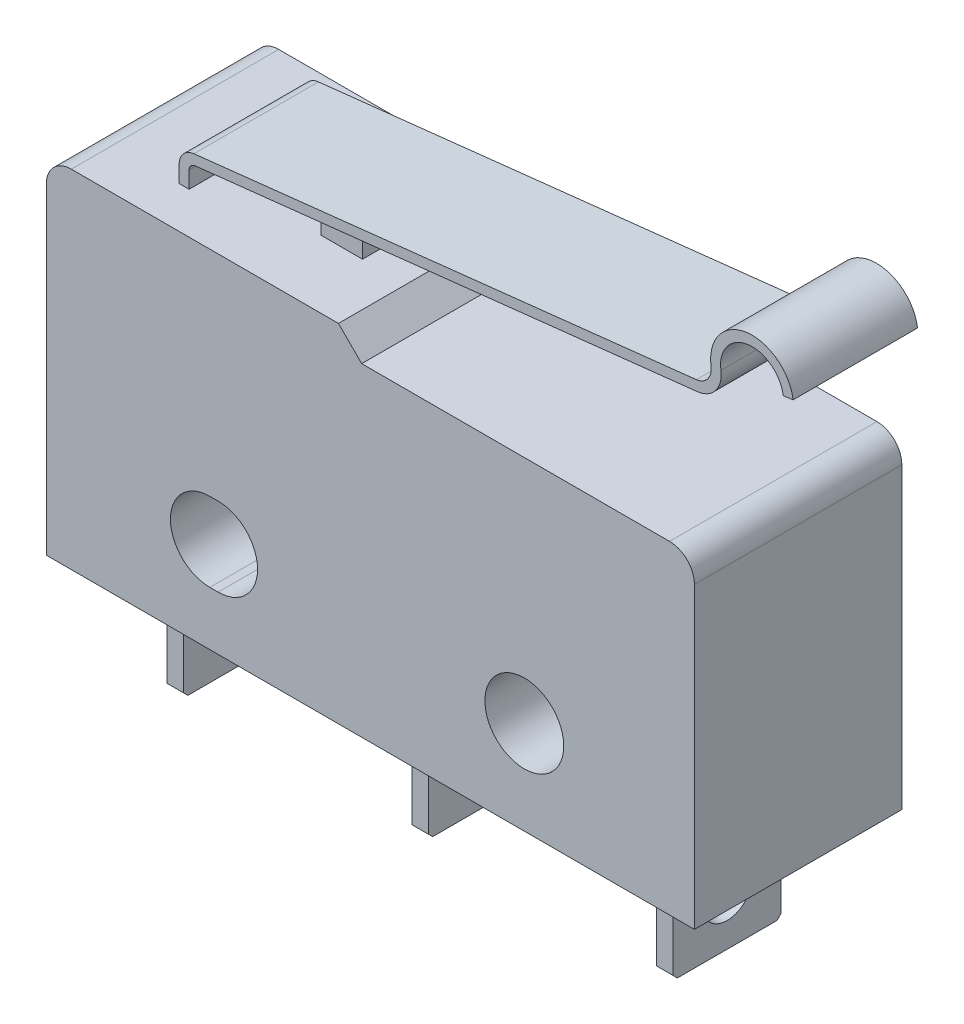
from build123d import *

# Parameters (mm, degrees)
SKETCH2_R           = 1.2065
EXTRUDE1_DEPTH      = 3.175
EXTRUDE2_DEPTH      = 1.1049
SKETCH10_R          = 0.762
EXTRUDE6_DEPTH      = 0.254
LPATTERN1_COUNT     = 3
LPATTERN1_PITCH     = 7.493
EXTRUDE_THIN1_DEPTH = 1.905


with BuildPart() as part:
    # Sketch2 → Extrude1 (new, symmetric)
    with BuildSketch(Plane.XY):
        with BuildLine():
            Line((-9.1567, 10.6172), (-4.9149, 10.6172))
            Line((-4.9149, 10.6172), (-0.9779, 10.6172))
            Line((-0.9779, 10.6172), (-0.2667, 9.906))
            Line((-0.2667, 9.906), (9.1567, 9.906))
            ThreePointArc((9.1567, 9.906), (9.695515367, 9.682815367), (9.9187, 9.144))
            Line((9.9187, 9.144), (9.9187, 0))
            Line((9.9187, 0), (-9.9187, 0))
            Line((-9.9187, 0), (-9.9187, 9.8552))
            ThreePointArc((-9.9187, 9.8552), (-9.695515367, 10.394015367), (-9.1567, 10.6172))
        make_face()
        with Locations((4.7117, 2.8575)):
            Circle(SKETCH2_R, mode=Mode.SUBTRACT)
        with BuildLine():
            Line((-4.9149, 4.064), (-4.6609, 4.064))
            ThreePointArc((-4.6609, 4.064), (-3.4544, 2.8575), (-4.6609, 1.651))
            Line((-4.6609, 1.651), (-4.9149, 1.651))
            ThreePointArc((-4.9149, 1.651), (-6.1214, 2.8575), (-4.9149, 4.064))
        make_face(mode=Mode.SUBTRACT)
    extrude(amount=EXTRUDE1_DEPTH, both=True)

    # Sketch10 → Extrude6 (add, symmetric)
    with BuildSketch(Plane(origin=(-7.493, 0, 0), x_dir=(0, 0, -1), z_dir=(1, 0, 0))):
        Polygon((-1.651, 0), (-1.651, -3.0734), (-1.524, -3.2004), (1.524, -3.2004), (1.651, -3.0734), (1.651, 0), align=None)
        with Locations((0, -1.6764)):
            Circle(SKETCH10_R, mode=Mode.SUBTRACT)
    extrude6 = extrude(amount=EXTRUDE6_DEPTH, both=True)

    # LPattern1: Extrude6 ×3
    with Locations(*[(i * LPATTERN1_PITCH, 0, 0) for i in range(1, LPATTERN1_COUNT)]):
        add(extrude6)



with BuildPart() as body_2:
    # Sketch3 → Extrude2 (new, symmetric)
    with BuildSketch(Plane.XY):
        with BuildLine():
            Line((-3.5814, 10.6172), (-3.5814, 11.524614746))
            ThreePointArc((-3.5814, 11.524614746), (-2.9464, 11.7475), (-2.3114, 11.524614746))
            Line((-2.3114, 11.524614746), (-2.3114, 10.6172))
            Line((-2.3114, 10.6172), (-3.5814, 10.6172))
        make_face()
    extrude(amount=EXTRUDE2_DEPTH, both=True)


with BuildPart() as part_1:
    add(part.part)

    add(body_2.part)  # Extrude-Thin1 merges body 2
    # Sketch11 → Extrude-Thin1 (add, symmetric)
    with BuildSketch(Plane.XY):
        with BuildLine():
            Line((-7.1247, 10.6172), (-7.1247, 11.128280087))
            ThreePointArc((-7.1247, 11.128280087), (-6.995143389, 11.467167386), (-6.672555901, 11.6332))
            Line((-6.672555901, 11.6332), (8.711185108, 13.335))
            ThreePointArc((8.711185108, 13.335), (9.057341476, 13.529355692), (9.157991006, 13.913371366))
            ThreePointArc((9.157991006, 13.913371366), (10.231016869, 15.353654497), (11.6713, 14.280628634))
            Line((11.6713, 14.280628634), (11.369702921, 14.236557762))
            ThreePointArc((11.369702921, 14.236557762), (10.275087741, 15.052057418), (9.459588085, 13.957442238))
            ThreePointArc((9.459588085, 13.957442238), (9.298548838, 13.343017159), (8.744698648, 13.032048052))
            Line((8.744698648, 13.032048052), (-6.63904236, 11.330248052))
            ThreePointArc((-6.63904236, 11.330248052), (-6.768077356, 11.263835007), (-6.8199, 11.128280087))
            Line((-6.8199, 11.128280087), (-6.8199, 10.6172))
            Line((-6.8199, 10.6172), (-7.1247, 10.6172))
        make_face()
    extrude(amount=EXTRUDE_THIN1_DEPTH, both=True)


solid = part_1.part
